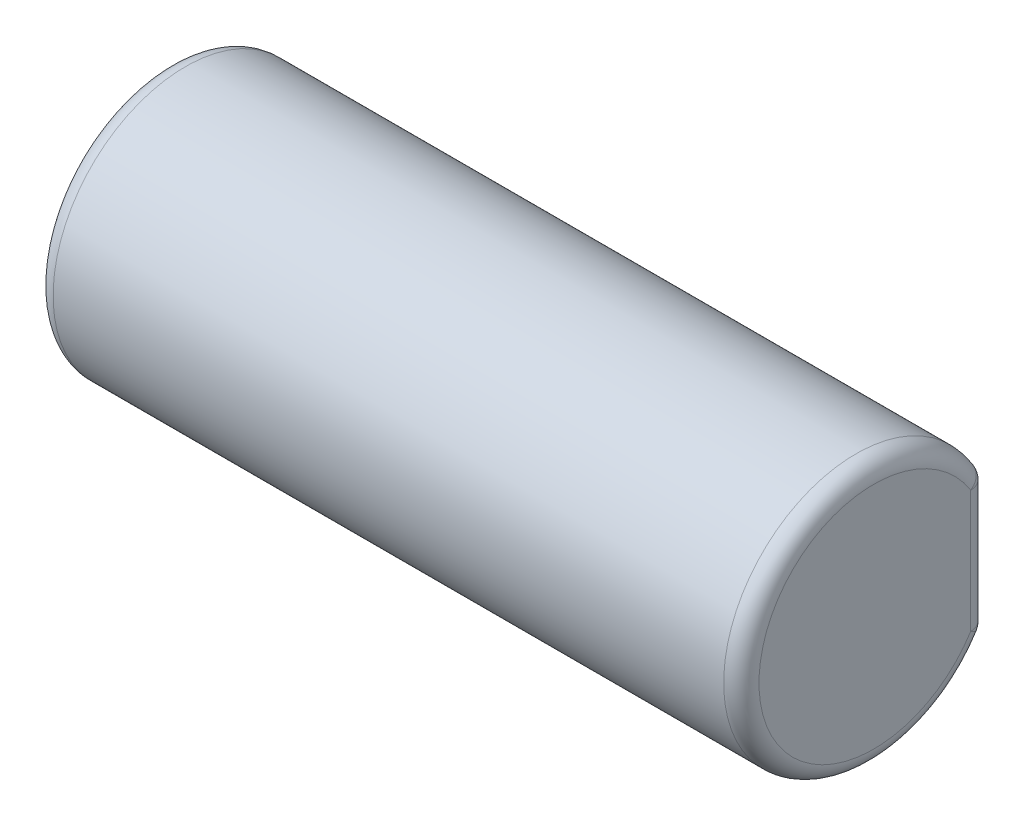
from build123d import *

# Parameters (mm, degrees)
BOSS_EXTRUDE1_DEPTH = 20
FILLET1_R           = 0.5


with BuildPart() as part:
    # Sketch1 → Boss-Extrude1 (new body)
    with BuildSketch(Plane(origin=(0, 0, 0), x_dir=(0, 0, -1), z_dir=(1, 0, 0))):
        with BuildLine():
            Line((3.25, -1.870828693), (3.25, 1.870828693))
            ThreePointArc((3.25, 1.870828693), (-3.75, 0), (3.25, -1.870828693))
        make_face()
    extrude(amount=BOSS_EXTRUDE1_DEPTH)

    # Fillet1
    fillet1_edges = [part.edges().sort_by_distance(p)[0] for p in [
        (10, 1.870828693, -3.25),
        (10, -1.870828693, -3.25),
        (20, 0, 3.75),
        (20, 0, -3.25),
        (0, 0, 3.75),
        (0, 0, -3.25),
    ]]
    fillet(fillet1_edges, radius=FILLET1_R)


solid = part.part
